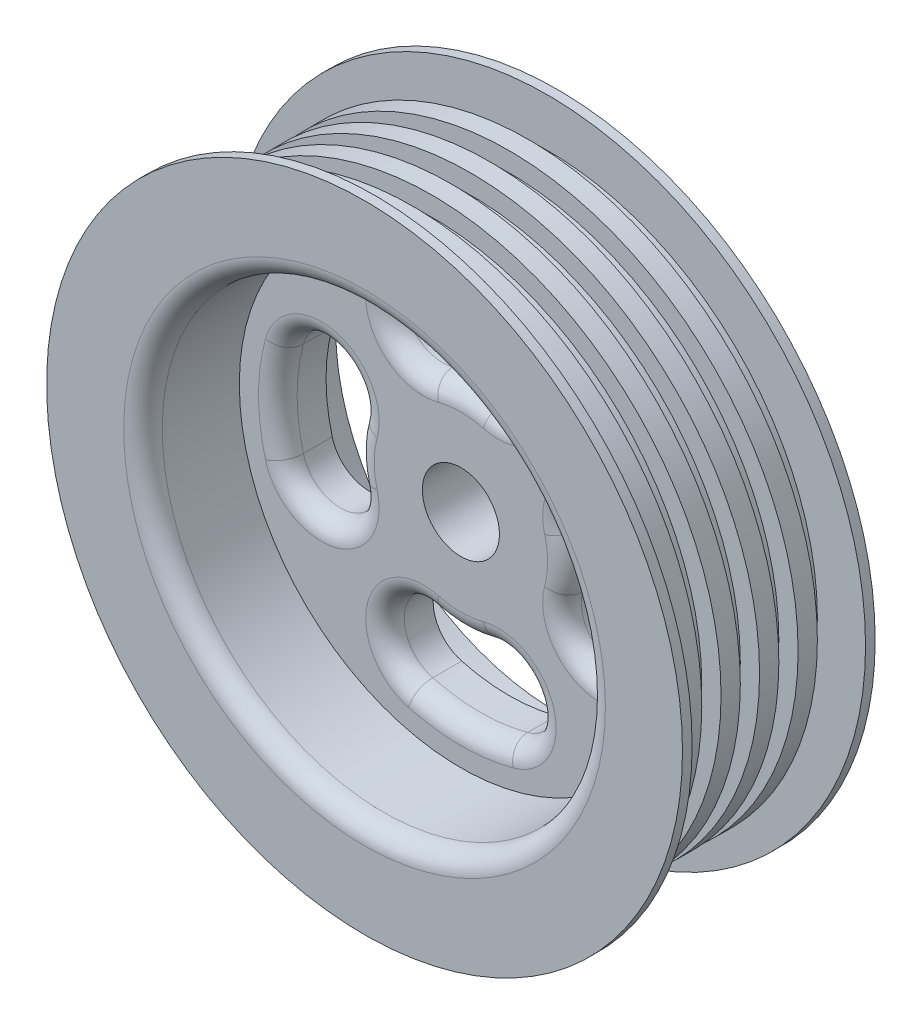
from build123d import *

# Parameters (mm, degrees)
SKETCH1_R           = 33
BOSS_EXTRUDE1_DEPTH = 20
SHELL1_T            = -10
SKETCH2_R           = 4
CUT_EXTRUDE1_DEPTH  = 48.728398255
SKETCH3_W           = 3
SKETCH3_H           = 18
SKETCH4_W           = 2
SKETCH4_H           = 2
LPATTERN1_COUNT     = 5
LPATTERN1_PITCH     = 4
SKETCH5_R           = 23
SKETCH5_R_2         = 7.5
CUT_EXTRUDE2_DEPTH  = 5
CUT_EXTRUDE3_DEPTH  = 5
CIRPATTERN1_COUNT   = 4
FILLET1_R           = 2
FILLET2_R           = 2


with BuildPart() as part:
    # Sketch1 → Boss-Extrude1 (new body)
    with BuildSketch(Plane.XY):
        Circle(SKETCH1_R)
    extrude(amount=BOSS_EXTRUDE1_DEPTH)

    # Shell1
    shell1_openings = [part.faces().sort_by_distance(p)[0] for p in [
        (0, 0, 20),
    ]]
    offset(amount=SHELL1_T, openings=shell1_openings, kind=Kind.INTERSECTION)

    # Sketch2 → Cut-Extrude1 (cut, through all)
    with BuildSketch(Plane.XY.offset(10)):
        Circle(SKETCH2_R)
    extrude(amount=-CUT_EXTRUDE1_DEPTH, mode=Mode.SUBTRACT)

    # Sketch3 → Cut-Revolve1 (revolve, cut)
    with BuildSketch(Plane(origin=(0, 0, 0), x_dir=(1, 0, 0), z_dir=(0, 1, 0))):
        with Locations((31.5, -10)):
            Rectangle(SKETCH3_W, SKETCH3_H)
    revolve(axis=Axis((0, 0, 20), (0, 0, -1)), mode=Mode.SUBTRACT)

    # Sketch4 → Cut-Revolve2 (revolve, cut)
    with BuildSketch(Plane(origin=(0, 0, 0), x_dir=(1, 0, 0), z_dir=(0, 1, 0))):
        with Locations((29, -2)):
            Rectangle(SKETCH4_W, SKETCH4_H)
    cut_revolve2 = revolve(axis=Axis((0, 0, 20), (0, 0, -1)), mode=Mode.SUBTRACT)

    # LPattern1: Cut-Revolve2 ×5
    with Locations(*[(0, 0, i * LPATTERN1_PITCH) for i in range(1, LPATTERN1_COUNT)]):
        add(cut_revolve2, mode=Mode.SUBTRACT)

    # Sketch5 → Cut-Extrude2 (cut)
    with BuildSketch(Plane(origin=(0, 0, 0), x_dir=(-1, 0, 0), z_dir=(0, 0, -1))):
        with Locations(Location((0, 0, 0), (0, 0, 180))):
            Circle(SKETCH5_R)
        Circle(SKETCH5_R_2, mode=Mode.SUBTRACT)
    extrude(amount=-CUT_EXTRUDE2_DEPTH, mode=Mode.SUBTRACT)

    # Sketch6 → Cut-Extrude3 (cut)
    with BuildSketch(Plane.XY.offset(10)):
        with BuildLine():
            ThreePointArc((4.917561857, 18.352590699), (0, 19), (-4.917561857, 18.352590699))
            ThreePointArc((-4.917561857, 18.352590699), (-7.745988982, 13.453611214), (-2.847009496, 10.625184089))
            ThreePointArc((-2.847009496, 10.625184089), (0, 11), (2.847009496, 10.625184089))
            ThreePointArc((2.847009496, 10.625184089), (7.745988982, 13.453611214), (4.917561857, 18.352590699))
        make_face()
    cut_extrude3 = extrude(amount=-CUT_EXTRUDE3_DEPTH, mode=Mode.SUBTRACT)

    # CirPattern1: Cut-Extrude3 ×4 about axis
    cirpattern1_axis = Axis((0, 0, 0), (0, 0, 1))
    for i in range(1, CIRPATTERN1_COUNT):
        add(cut_extrude3.rotate(cirpattern1_axis, i * 360 / CIRPATTERN1_COUNT), mode=Mode.SUBTRACT)

    # Fillet1
    fillet1_edges = [part.edges().sort_by_distance(p)[0] for p in [
        (7.745988982, 13.453611214, 10),
        (0, 19, 10),
        (-7.745988982, 13.453611214, 10),
        (0, 11, 10),
        (-13.453611214, 7.745988982, 10),
        (-19, 0, 10),
        (-13.453611214, -7.745988982, 10),
        (-11, 0, 10),
        (-7.745988982, -13.453611214, 10),
        (0, -19, 10),
        (7.745988982, -13.453611214, 10),
        (0, -11, 10),
        (13.453611214, -7.745988982, 10),
        (19, 0, 10),
        (13.453611214, 7.745988982, 10),
        (11, 0, 10),
    ]]
    fillet(fillet1_edges, radius=FILLET1_R)

    # Fillet2
    fillet2_edges = [part.edges().sort_by_distance(p)[0] for p in [
        (-23, 0, 20),
    ]]
    fillet(fillet2_edges, radius=FILLET2_R)


solid = part.part
